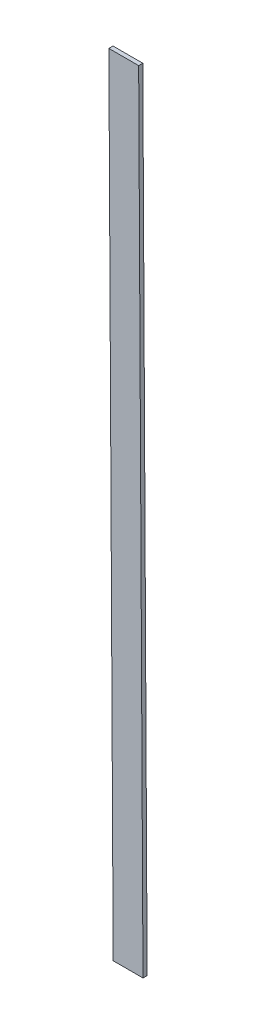
from build123d import *

# Parameters (mm, degrees)
BOSS_EXTRUDE1_DEPTH = 1.5875


with BuildPart() as part:
    # Sketch1 → Boss-Extrude1 (new body)
    with BuildSketch(Plane.XY):
        Polygon((-14.629205069, -88.460326639), (-26.063119292, -88.460326639), (-27.728341066, 213.806796442), (-16.294422033, 213.806796442), align=None)
    extrude(amount=BOSS_EXTRUDE1_DEPTH)


solid = part.part
